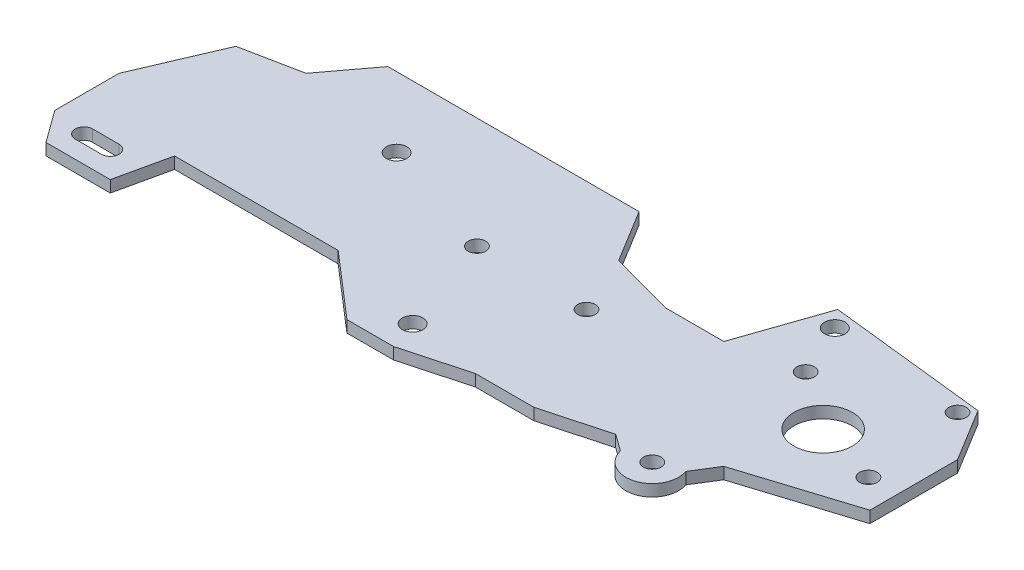
from build123d import *

# Parameters (mm, degrees)
SKETCH1_R           = 1.75
SKETCH1_R_2         = 1.5
SKETCH1_R_3         = 5
BOSS_EXTRUDE1_DEPTH = 2


with BuildPart() as part:
    # Sketch1 → Boss-Extrude1 (new body)
    with BuildSketch(Plane(origin=(0, 0, 0), x_dir=(1, 0, 0), z_dir=(0, 1, 0))):
        with BuildLine():
            Line((0, 0), (43, 0))
            Line((43, 0), (48.5, -9))
            Line((48.5, -9), (59.5, -12))
            Line((59.5, -12), (69.5, -12))
            Line((69.5, -12), (74.5, 2.5))
            Line((74.5, 2.5), (101.5, -0.5))
            Line((101.5, -0.5), (107, -9.5))
            Line((107, -9.5), (107, -24.5))
            Line((107, -24.5), (88, -30.5))
            Line((88, -30.5), (85.5, -34.5))
            ThreePointArc((85.5, -34.5), (82.533474843, -40.320323174), (76.870377201, -37.063674828))
            Line((76.870377201, -37.063674828), (74, -35))
            Line((74, -35), (63, -38))
            Line((63, -38), (53, -38))
            Line((53, -38), (42, -41))
            Line((42, -41), (34, -41))
            Line((34, -41), (23, -31.5))
            Line((23, -31.5), (-5, -31.5))
            Line((-5, -31.5), (-7, -40.5))
            Line((-7, -40.5), (-18, -40.5))
            Line((-18, -40.5), (-22, -35))
            Line((-22, -35), (-22, -24))
            Line((-22, -24), (-16, -10))
            Line((-16, -10), (-6, -8))
            Line((-6, -8), (0, 0))
        make_face()
        with Locations(Location((40.25, -36, 0), (0, 0, 270))):
            Circle(SKETCH1_R, mode=Mode.SUBTRACT)
        with Locations(Location((81.25, -36, 0), (0, 0, 270))):
            Circle(SKETCH1_R_2, mode=Mode.SUBTRACT)
        with Locations(Location((91, -16.5, 0), (0, 0, 270))):
            Circle(SKETCH1_R_3, mode=Mode.SUBTRACT)
        with Locations(Location((77, -0.5, 0), (0, 0, 270))):
            Circle(SKETCH1_R, mode=Mode.SUBTRACT)
        with Locations(Location((81, -9.5, 0), (0, 0, 270))):
            Circle(SKETCH1_R_2, mode=Mode.SUBTRACT)
        with Locations(Location((100, -2.5, 0), (0, 0, 270))):
            Circle(SKETCH1_R_2, mode=Mode.SUBTRACT)
        with Locations(Location((102, -19.75, 0), (0, 0, 270))):
            Circle(SKETCH1_R_2, mode=Mode.SUBTRACT)
        with Locations(Location((53, -19, 0), (0, 0, 270))):
            Circle(SKETCH1_R_2, mode=Mode.SUBTRACT)
        with Locations(Location((34.25, -19, 0), (0, 0, 270))):
            Circle(SKETCH1_R_2, mode=Mode.SUBTRACT)
        with Locations(Location((13.5, -12, 0), (0, 0, 270))):
            Circle(SKETCH1_R, mode=Mode.SUBTRACT)
        with BuildLine():
            Line((-16, -34.5), (-11.5, -34.5))
            ThreePointArc((-11.5, -34.5), (-10, -36), (-11.5, -37.5))
            Line((-11.5, -37.5), (-16, -37.5))
            ThreePointArc((-16, -37.5), (-17.5, -36), (-16, -34.5))
        make_face(mode=Mode.SUBTRACT)
    extrude(amount=BOSS_EXTRUDE1_DEPTH)


solid = part.part
